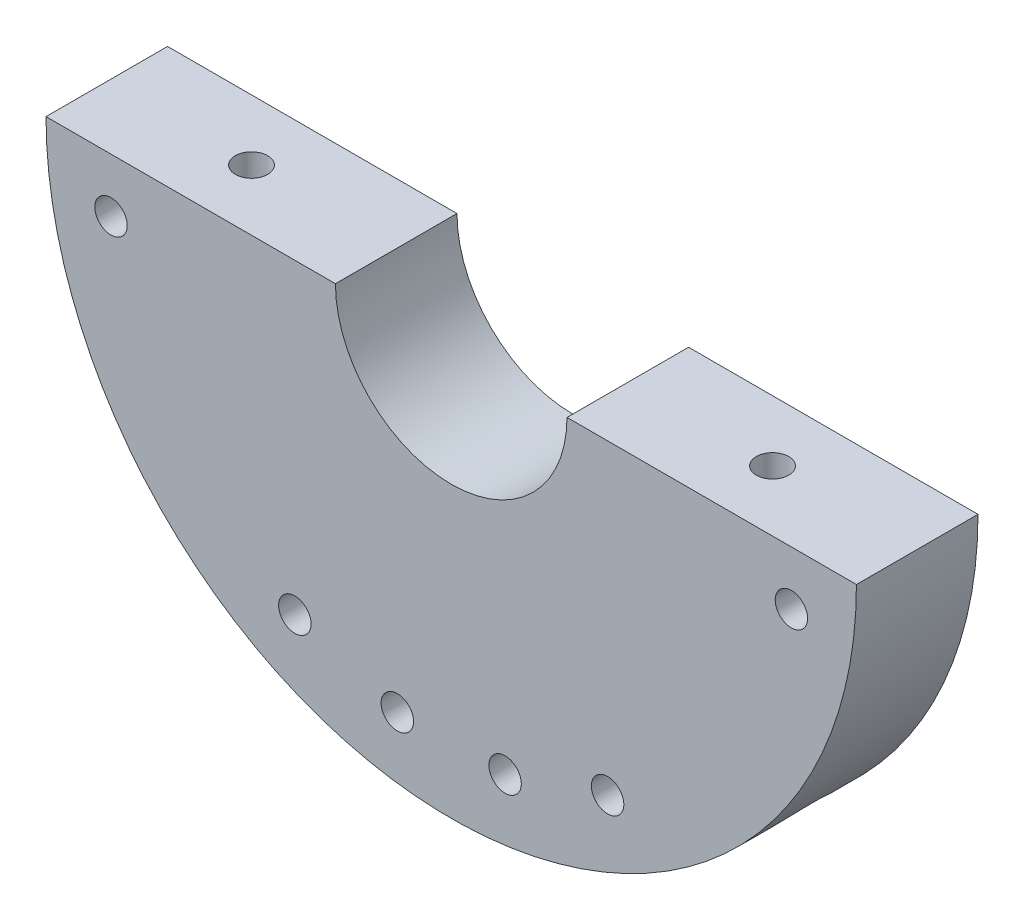
from build123d import *

# Parameters (mm, degrees)
DODANIE_WYCI_GNI_CIE1_DEPTH = 30
SZKIC2_R                    = 4
WYTNIJ_WYCI_GNI_CIE1_DEPTH  = 145.568322948
SZKIC3_R                    = 10
WYTNIJ_WYCI_GNI_CIE2_DEPTH  = 135.629120338
WYTNIJ_WYCI_GNI_CIE5_DEPTH  = 145.568323107


with BuildPart() as part:
    # Szkic1 → Dodanie-wyciągnięcie1 (new body)
    with BuildSketch(Plane.XY):
        with BuildLine():
            Line((-100, 0), (-28.575, 0))
            ThreePointArc((-28.575, 0), (0, -28.575), (28.575, 0))
            Line((28.575, 0), (100, 0))
            ThreePointArc((100, 0), (0, -100), (-100, 0))
        make_face()
    extrude(amount=DODANIE_WYCI_GNI_CIE1_DEPTH)

    # Szkic2 → Wytnij-wyciągnięcie1 (cut, through all)
    with BuildSketch(Plane(origin=(0, 0, 0), x_dir=(1, 0, 0), z_dir=(0, 1, 0))):
        with Locations(Location((-64.2875, -15, 0), (0, 0, 270))):
            Circle(SZKIC2_R)
        with Locations(Location((64.2875, -15, 0), (0, 0, 270))):
            Circle(SZKIC2_R)
    extrude(amount=-WYTNIJ_WYCI_GNI_CIE1_DEPTH, mode=Mode.SUBTRACT)

    # Szkic3 → Wytnij-wyciągnięcie2 (cut, through all)
    with BuildSketch(Plane(origin=(0, -15, 0), x_dir=(1, 0, 0), z_dir=(0, 1, 0))):
        with Locations(Location((64.2875, -15, 0), (0, 0, 270))):
            Circle(SZKIC3_R)
        with Locations(Location((-64.2875, -15, 0), (0, 0, 270))):
            Circle(SZKIC3_R)
    extrude(amount=-WYTNIJ_WYCI_GNI_CIE2_DEPTH, mode=Mode.SUBTRACT)

    # Szkic5 → Wytnij-wyciągnięcie5 (cut, through all)
    with BuildSketch(Plane(origin=(0, 0, 0), x_dir=(-1, 0, 0), z_dir=(0, 0, -1))):
        with BuildLine():
            ThreePointArc((84.486114669, -9.332546708), (80.002755588, -12.671191668), (83.234985426, -17.231865861))
            ThreePointArc((83.234985426, -17.231865861), (83.953508951, -13.296929528), (84.486114669, -9.332546708))
        make_face()
        with BuildLine():
            ThreePointArc((84.486114669, -9.332546708), (83.953508951, -13.296929528), (83.234985426, -17.231865861))
            ThreePointArc((83.234985426, -17.231865861), (86.515335048, -16.368907238), (87.953508951, -13.296929528))
            ThreePointArc((87.953508951, -13.296929528), (86.964357907, -10.663530857), (84.486114669, -9.332546708))
        make_face()
        with BuildLine():
            ThreePointArc((84.486114669, -9.332546708), (80.002755588, -12.671191668), (83.234985426, -17.231865861))
            ThreePointArc((83.234985426, -17.231865861), (83.953508951, -13.296929528), (84.486114669, -9.332546708))
        make_face()
        with BuildLine():
            ThreePointArc((84.486114669, -9.332546708), (83.953508951, -13.296929528), (83.234985426, -17.231865861))
            ThreePointArc((83.234985426, -17.231865861), (86.515335048, -16.368907238), (87.953508951, -13.296929528))
            ThreePointArc((87.953508951, -13.296929528), (86.964357907, -10.663530857), (84.486114669, -9.332546708))
        make_face()
        with BuildLine():
            ThreePointArc((42.109503339, -73.836235878), (36.773230479, -72.171528459), (34.983424582, -77.467154359))
            ThreePointArc((34.983424582, -77.467154359), (38.589192478, -75.735554556), (42.109503339, -73.836235878))
        make_face()
        with BuildLine():
            ThreePointArc((42.109503339, -73.836235878), (38.589192478, -75.735554556), (34.983424582, -77.467154359))
            ThreePointArc((34.983424582, -77.467154359), (39.477147549, -79.635751447), (42.589192478, -75.735554556))
            ThreePointArc((42.589192478, -75.735554556), (42.46741652, -74.756075981), (42.109503339, -73.836235878))
        make_face()
        with BuildLine():
            ThreePointArc((42.109503339, -73.836235878), (36.773230479, -72.171528459), (34.983424582, -77.467154359))
            ThreePointArc((34.983424582, -77.467154359), (38.589192478, -75.735554556), (42.109503339, -73.836235878))
        make_face()
        with BuildLine():
            ThreePointArc((42.109503339, -73.836235878), (38.589192478, -75.735554556), (34.983424582, -77.467154359))
            ThreePointArc((34.983424582, -77.467154359), (39.477147549, -79.635751447), (42.589192478, -75.735554556))
            ThreePointArc((42.589192478, -75.735554556), (42.46741652, -74.756075981), (42.109503339, -73.836235878))
        make_face()
        with BuildLine():
            ThreePointArc((17.231865861, -83.234985426), (12.671191668, -80.002755588), (9.332546708, -84.486114669))
            ThreePointArc((9.332546708, -84.486114669), (13.296929528, -83.953508951), (17.231865861, -83.234985426))
        make_face()
        with BuildLine():
            ThreePointArc((17.231865861, -83.234985426), (13.296929528, -83.953508951), (9.332546708, -84.486114669))
            ThreePointArc((9.332546708, -84.486114669), (13.563827184, -87.944594723), (17.296929528, -83.953508951))
            ThreePointArc((17.296929528, -83.953508951), (17.280630404, -83.592777286), (17.231865861, -83.234985426))
        make_face()
        with BuildLine():
            ThreePointArc((17.231865861, -83.234985426), (12.671191668, -80.002755588), (9.332546708, -84.486114669))
            ThreePointArc((9.332546708, -84.486114669), (13.296929528, -83.953508951), (17.231865861, -83.234985426))
        make_face()
        with BuildLine():
            ThreePointArc((17.231865861, -83.234985426), (13.296929528, -83.953508951), (9.332546708, -84.486114669))
            ThreePointArc((9.332546708, -84.486114669), (13.563827184, -87.944594723), (17.296929528, -83.953508951))
            ThreePointArc((17.296929528, -83.953508951), (17.280630404, -83.592777286), (17.231865861, -83.234985426))
        make_face()
        with BuildLine():
            ThreePointArc((-17.231865861, -83.234985426), (-13.296929528, -83.953508951), (-9.332546708, -84.486114669))
            ThreePointArc((-9.332546708, -84.486114669), (-9.305843756, -84.220406607), (-9.296929528, -83.953508951))
            ThreePointArc((-9.296929528, -83.953508951), (-12.936197864, -79.969808075), (-17.231865861, -83.234985426))
        make_face()
        with BuildLine():
            ThreePointArc((-17.231865861, -83.234985426), (-13.922667389, -87.904262313), (-9.332546708, -84.486114669))
            ThreePointArc((-9.332546708, -84.486114669), (-13.296929528, -83.953508951), (-17.231865861, -83.234985426))
        make_face()
        with BuildLine():
            ThreePointArc((-17.231865861, -83.234985426), (-13.296929528, -83.953508951), (-9.332546708, -84.486114669))
            ThreePointArc((-9.332546708, -84.486114669), (-9.305843756, -84.220406607), (-9.296929528, -83.953508951))
            ThreePointArc((-9.296929528, -83.953508951), (-12.936197864, -79.969808075), (-17.231865861, -83.234985426))
        make_face()
        with BuildLine():
            ThreePointArc((-17.231865861, -83.234985426), (-13.922667389, -87.904262313), (-9.332546708, -84.486114669))
            ThreePointArc((-9.332546708, -84.486114669), (-13.296929528, -83.953508951), (-17.231865861, -83.234985426))
        make_face()
        with BuildLine():
            ThreePointArc((-34.983424582, -77.467154359), (-36.796495821, -76.622567794), (-38.589192478, -75.735554556))
            ThreePointArc((-38.589192478, -75.735554556), (-40.360521918, -74.806605795), (-42.109503339, -73.836235878))
            ThreePointArc((-42.109503339, -73.836235878), (-40.405154477, -79.299580653), (-34.983424582, -77.467154359))
        make_face()
        with BuildLine():
            ThreePointArc((-34.589192478, -75.735554556), (-35.17863182, -73.645560297), (-36.773230479, -72.171528459))
            Line((-36.773230479, -72.171528459), (-38.589192478, -75.735554556))
            ThreePointArc((-38.589192478, -75.735554556), (-36.796495821, -76.622567794), (-34.983424582, -77.467154359))
            ThreePointArc((-34.983424582, -77.467154359), (-34.688995586, -76.623509627), (-34.589192478, -75.735554556))
        make_face()
        with BuildLine():
            Line((-38.589192478, -75.735554556), (-36.773230479, -72.171528459))
            ThreePointArc((-36.773230479, -72.171528459), (-39.780416201, -71.917048822), (-42.109503339, -73.836235878))
            ThreePointArc((-42.109503339, -73.836235878), (-40.360521918, -74.806605795), (-38.589192478, -75.735554556))
        make_face()
        with BuildLine():
            ThreePointArc((-34.589192478, -75.735554556), (-35.17863182, -73.645560297), (-36.773230479, -72.171528459))
            Line((-36.773230479, -72.171528459), (-38.589192478, -75.735554556))
            ThreePointArc((-38.589192478, -75.735554556), (-36.796495821, -76.622567794), (-34.983424582, -77.467154359))
            ThreePointArc((-34.983424582, -77.467154359), (-34.688995586, -76.623509627), (-34.589192478, -75.735554556))
        make_face()
        with BuildLine():
            Line((-38.589192478, -75.735554556), (-36.773230479, -72.171528459))
            ThreePointArc((-36.773230479, -72.171528459), (-39.780416201, -71.917048822), (-42.109503339, -73.836235878))
            ThreePointArc((-42.109503339, -73.836235878), (-40.360521918, -74.806605795), (-38.589192478, -75.735554556))
        make_face()
        with BuildLine():
            ThreePointArc((-84.486114669, -9.332546708), (-87.904262313, -13.922667389), (-83.234985426, -17.231865861))
            ThreePointArc((-83.234985426, -17.231865861), (-83.953508951, -13.296929528), (-84.486114669, -9.332546708))
        make_face()
        with BuildLine():
            ThreePointArc((-84.486114669, -9.332546708), (-83.953508951, -13.296929528), (-83.234985426, -17.231865861))
            ThreePointArc((-83.234985426, -17.231865861), (-80.881531241, -15.858755625), (-79.953508951, -13.296929528))
            ThreePointArc((-79.953508951, -13.296929528), (-81.320110279, -10.286080572), (-84.486114669, -9.332546708))
        make_face()
        with BuildLine():
            ThreePointArc((-84.486114669, -9.332546708), (-87.904262313, -13.922667389), (-83.234985426, -17.231865861))
            ThreePointArc((-83.234985426, -17.231865861), (-83.953508951, -13.296929528), (-84.486114669, -9.332546708))
        make_face()
        with BuildLine():
            ThreePointArc((-84.486114669, -9.332546708), (-83.953508951, -13.296929528), (-83.234985426, -17.231865861))
            ThreePointArc((-83.234985426, -17.231865861), (-80.881531241, -15.858755625), (-79.953508951, -13.296929528))
            ThreePointArc((-79.953508951, -13.296929528), (-81.320110279, -10.286080572), (-84.486114669, -9.332546708))
        make_face()
    extrude(amount=-WYTNIJ_WYCI_GNI_CIE5_DEPTH, mode=Mode.SUBTRACT)


solid = part.part
